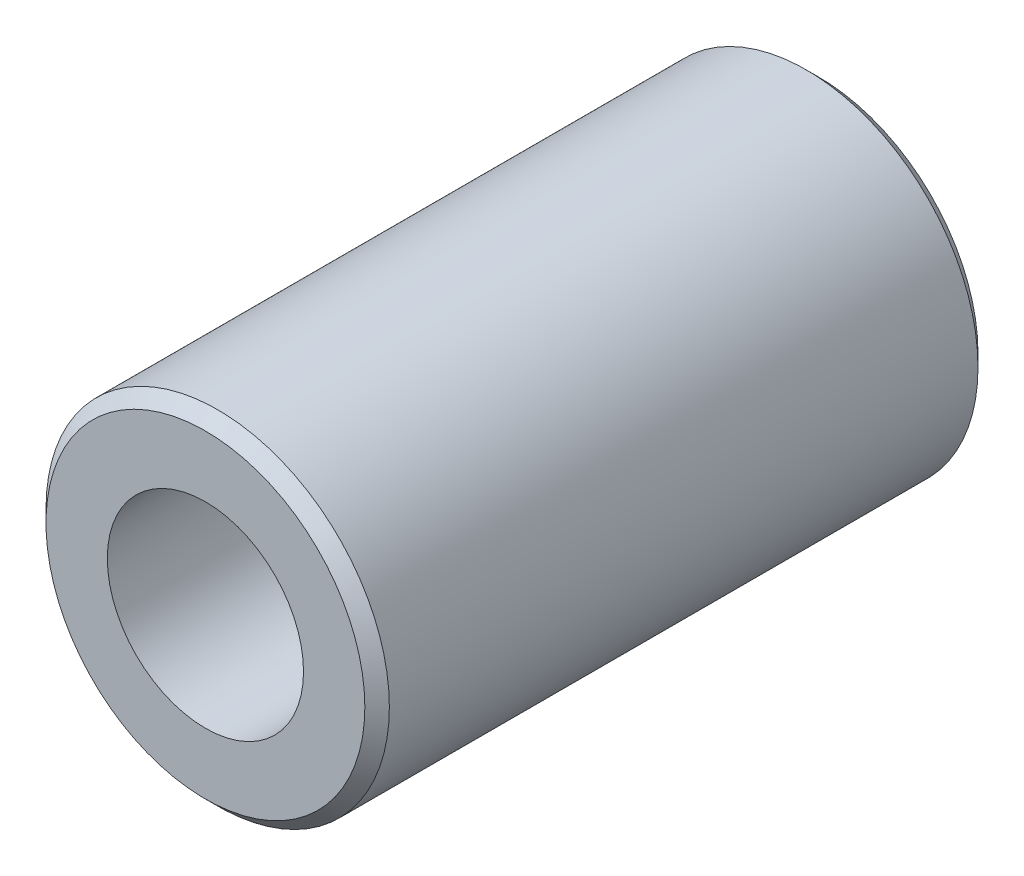
from build123d import *

# Parameters (mm, degrees)
SKETCH1_R           = 7
BOSS_EXTRUDE1_DEPTH = 25
SKETCH3_R           = 4
CUT_EXTRUDE1_DEPTH  = 12.5
SKETCH4_R           = 2.5
CUT_EXTRUDE2_DEPTH  = 14.5
CHAMFER1_SIZE       = 0.5


with BuildPart() as part:
    # Sketch1 → Boss-Extrude1 (new body)
    with BuildSketch(Plane.XY):
        Circle(SKETCH1_R)
    extrude(amount=BOSS_EXTRUDE1_DEPTH)

    # Sketch3 → Cut-Extrude1 (cut)
    with BuildSketch(Plane.XY.offset(25)):
        Circle(SKETCH3_R)
    extrude(amount=-CUT_EXTRUDE1_DEPTH, mode=Mode.SUBTRACT)

    # Sketch4 → Cut-Extrude2 (cut)
    with BuildSketch(Plane.XY.offset(12.5)):
        Circle(SKETCH4_R)
    extrude(amount=-CUT_EXTRUDE2_DEPTH, mode=Mode.SUBTRACT)

    # Chamfer1
    chamfer1_edges = [part.edges().sort_by_distance(p)[0] for p in [
        (-7, 0, 0),
        (-7, 0, 25),
    ]]
    chamfer(chamfer1_edges, length=CHAMFER1_SIZE)


solid = part.part
